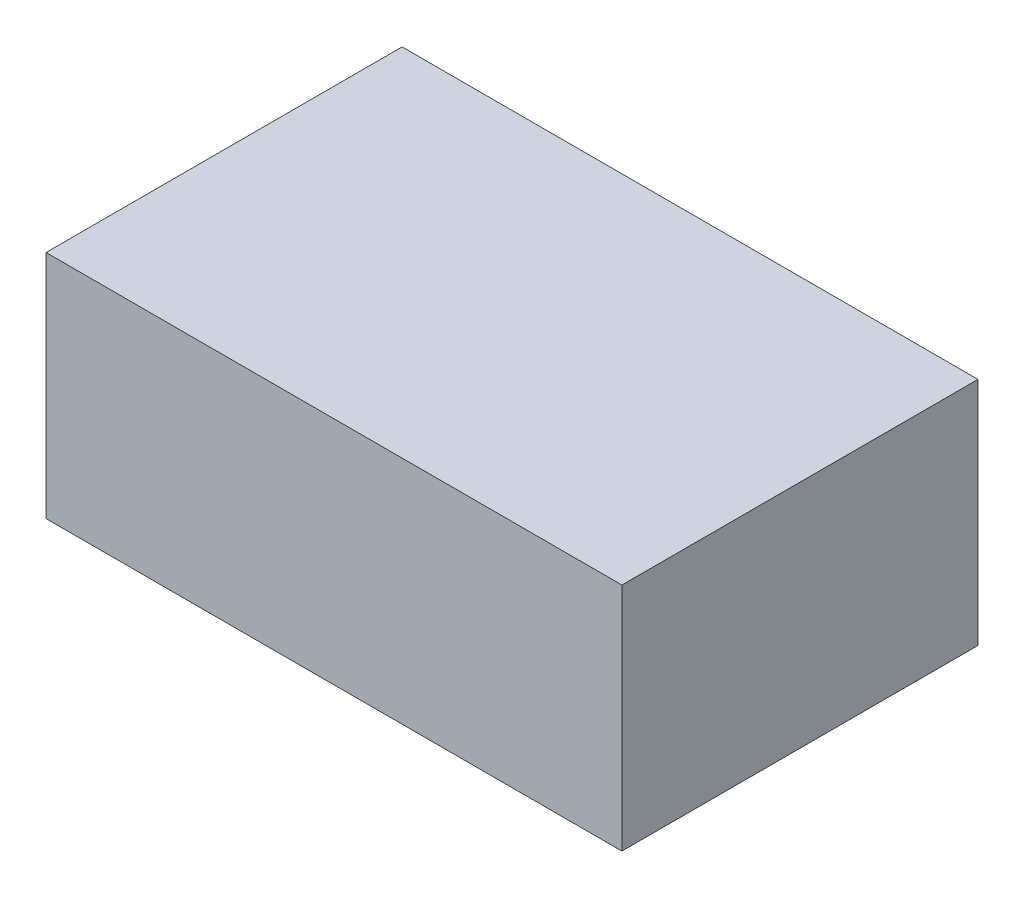
from build123d import *

# Parameters (mm, degrees)
SKETCH1_W           = 158.685463525
SKETCH1_H           = 98.122128075
BOSS_EXTRUDE1_DEPTH = 63.5


with BuildPart() as part:
    # Sketch1 → Boss-Extrude1 (new body)
    with BuildSketch(Plane(origin=(0, 0, 0), x_dir=(1, 0, 0), z_dir=(0, 1, 0))):
        with Locations((79.342731763, 49.061064038)):
            Rectangle(SKETCH1_W, SKETCH1_H)
    extrude(amount=BOSS_EXTRUDE1_DEPTH)


solid = part.part
